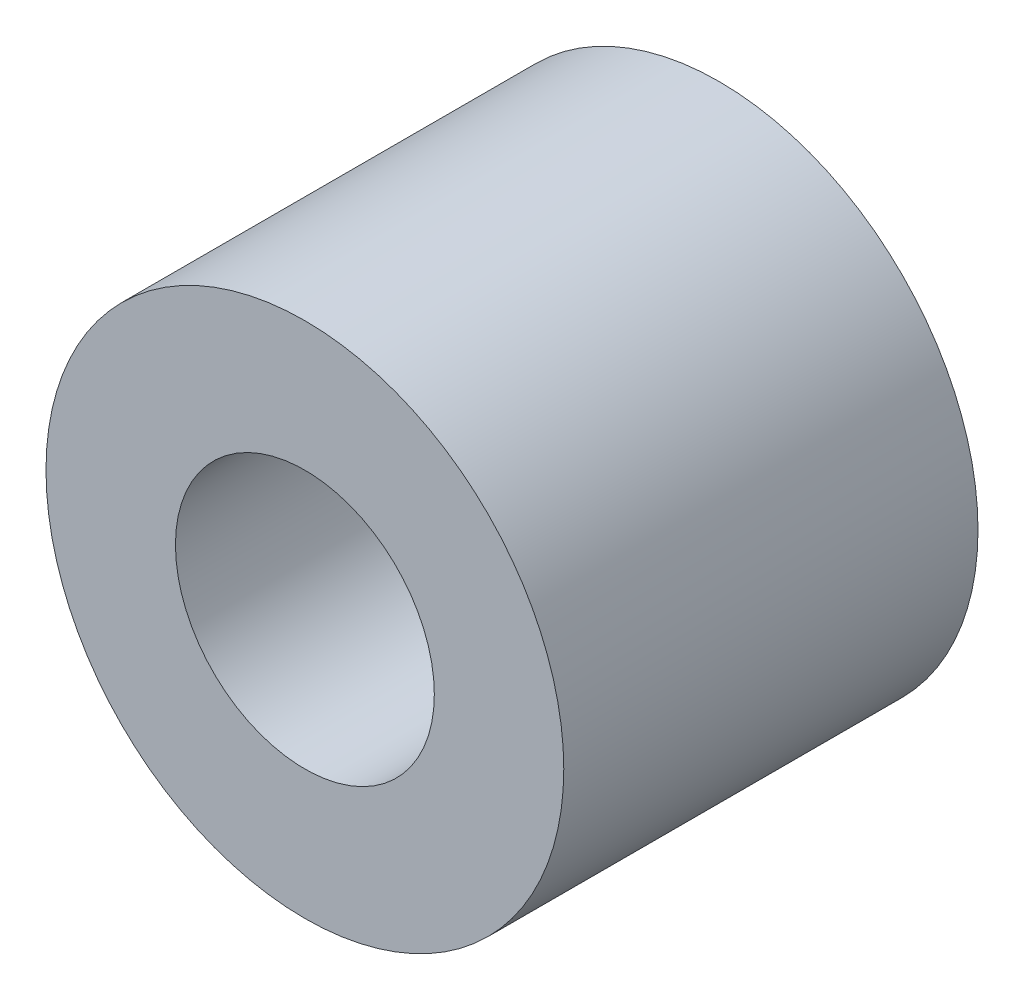
from build123d import *

# Parameters (mm, degrees)
SKETCH1_R           = 3.175
BOSS_EXTRUDE1_DEPTH = 5.08
SKETCH2_R           = 1.5875
CUT_EXTRUDE1_DEPTH  = 3.81


with BuildPart() as part:
    # Sketch1 → Boss-Extrude1 (new body)
    with BuildSketch(Plane.XY):
        Circle(SKETCH1_R)
    extrude(amount=BOSS_EXTRUDE1_DEPTH)

    # Sketch2 → Cut-Extrude1 (cut)
    with BuildSketch(Plane.XY.offset(5.08)):
        Circle(SKETCH2_R)
    extrude(amount=-CUT_EXTRUDE1_DEPTH, mode=Mode.SUBTRACT)


solid = part.part
